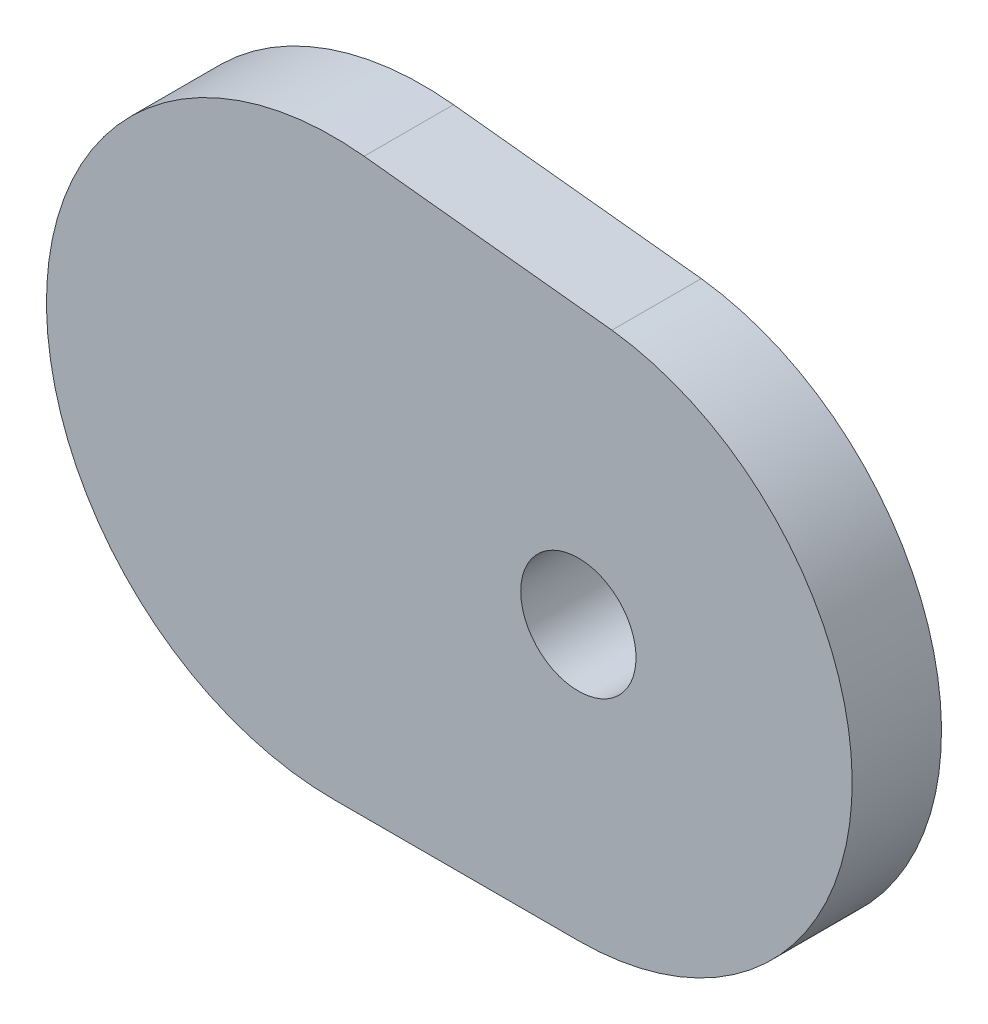
from build123d import *

# Parameters (mm, degrees)
SKETCH1_R           = 4
BOSS_EXTRUDE1_DEPTH = 6.2


with BuildPart() as part:
    # Sketch1 → Boss-Extrude1 (new body)
    with BuildSketch(Plane.XY):
        with BuildLine():
            Line((-16.999999933, -19.000000057), (6.4e-08, -19))
            ThreePointArc((6.4e-08, -19), (18.964168293, -1.166327985), (2.328256926, 18.856808311))
            Line((2.328256926, 18.856808311), (-14.868267557, 20.708519018))
            ThreePointArc((-14.868267557, 20.708519018), (-36.882849209, 1.978880998), (-16.999999933, -19.000000057))
        make_face()
        with Locations(Location((0, 0, 0), (0, 0, 180))):
            Circle(SKETCH1_R, mode=Mode.SUBTRACT)
    extrude(amount=BOSS_EXTRUDE1_DEPTH)


solid = part.part
